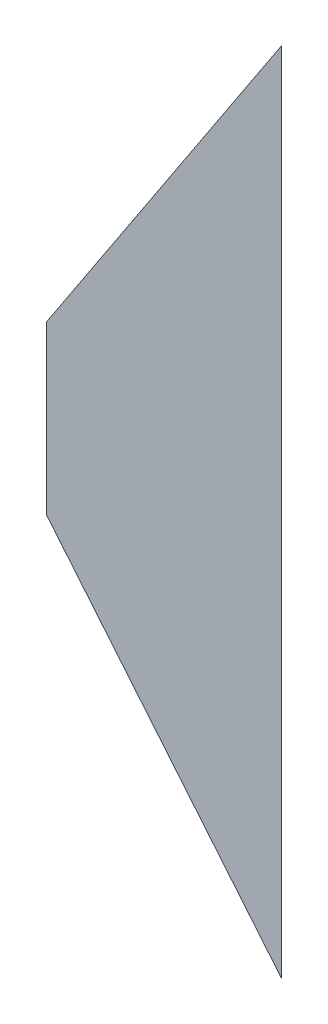
from build123d import *


with BuildPart() as part:
    # Esquisse1 → Lissage5 section 0
    with BuildSketch(Plane.XY):
        with BuildLine():
            Line((6.99999999999957, 10.624355652981246), (0, -1.52e-15))
            Line((0, -1.52e-15), (0, -5.000000000000009))
            Line((0, -5.000000000000009), (6.999999999999597, -13.458548115672496))
            Line((6.999999999999597, -13.458548115672496), (6.99999999999957, 10.624355652981246))
        make_face()
    # Esquisse2 → Lissage5 section 1
    with BuildSketch(Plane(origin=(0, 0, 0), x_dir=(0, 0, -1), z_dir=(1, 0, 0))):
        with BuildLine():
            Line((0, 0), (0, -5.000000000000009))
            Line((0, -5.000000000000009), (2.6, -5.000000000000009))
            Line((2.6, -5.000000000000009), (2.6, 0))
            Line((2.6, 0), (0, 0))
        make_face()
    loft()


solid = part.part
